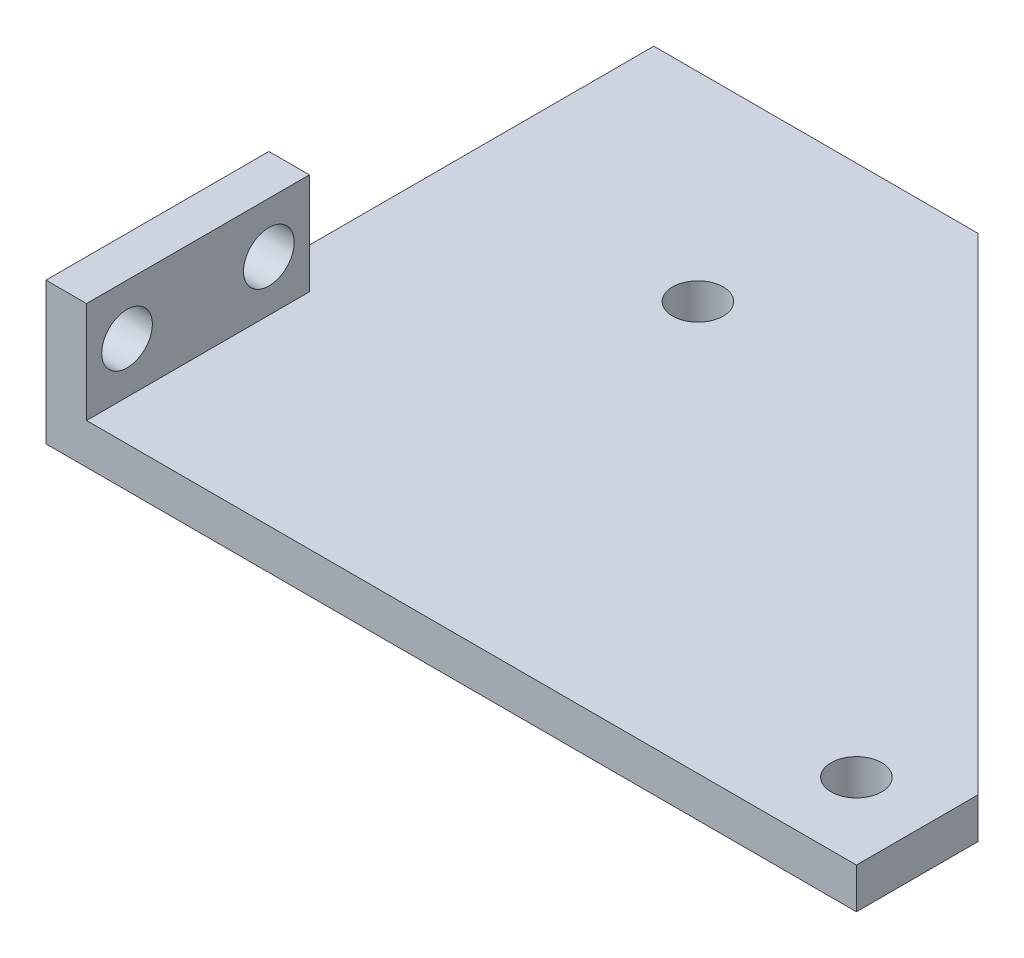
from build123d import *

# Parameters (mm, degrees)
SKETCH1_R           = 2.5
BOSS_EXTRUDE1_DEPTH = 4
SKETCH2_W           = 4
SKETCH2_H           = 22
BOSS_EXTRUDE2_DEPTH = 10
SKETCH3_R           = 2.5
CUT_EXTRUDE1_DEPTH  = 20


with BuildPart() as part:
    # Sketch1 → Boss-Extrude1 (new body)
    with BuildSketch(Plane(origin=(0, 0, 0), x_dir=(1, 0, 0), z_dir=(0, 1, 0))):
        Polygon((32, 60), (80, 12), (80, 0), (0, 0), (0, 60), align=None)
        with Locations(Location((24, 40.35, 0), (0, 0, 270))):
            Circle(SKETCH1_R, mode=Mode.SUBTRACT)
        with Locations(Location((72.5, 7.5, 0), (0, 0, 270))):
            Circle(SKETCH1_R, mode=Mode.SUBTRACT)
    extrude(amount=BOSS_EXTRUDE1_DEPTH)

    # Sketch2 → Boss-Extrude2 (add)
    with BuildSketch(Plane(origin=(0, 4, 0), x_dir=(1, 0, 0), z_dir=(0, 1, 0))):
        with Locations((2, 11)):
            Rectangle(SKETCH2_W, SKETCH2_H)
    extrude(amount=BOSS_EXTRUDE2_DEPTH)

    # Sketch3 → Cut-Extrude1 (cut)
    with BuildSketch(Plane.ZY):
        with Locations((-18, 9)):
            Circle(SKETCH3_R)
        with Locations((-4, 9)):
            Circle(SKETCH3_R)
    extrude(amount=-CUT_EXTRUDE1_DEPTH, mode=Mode.SUBTRACT)


solid = part.part
